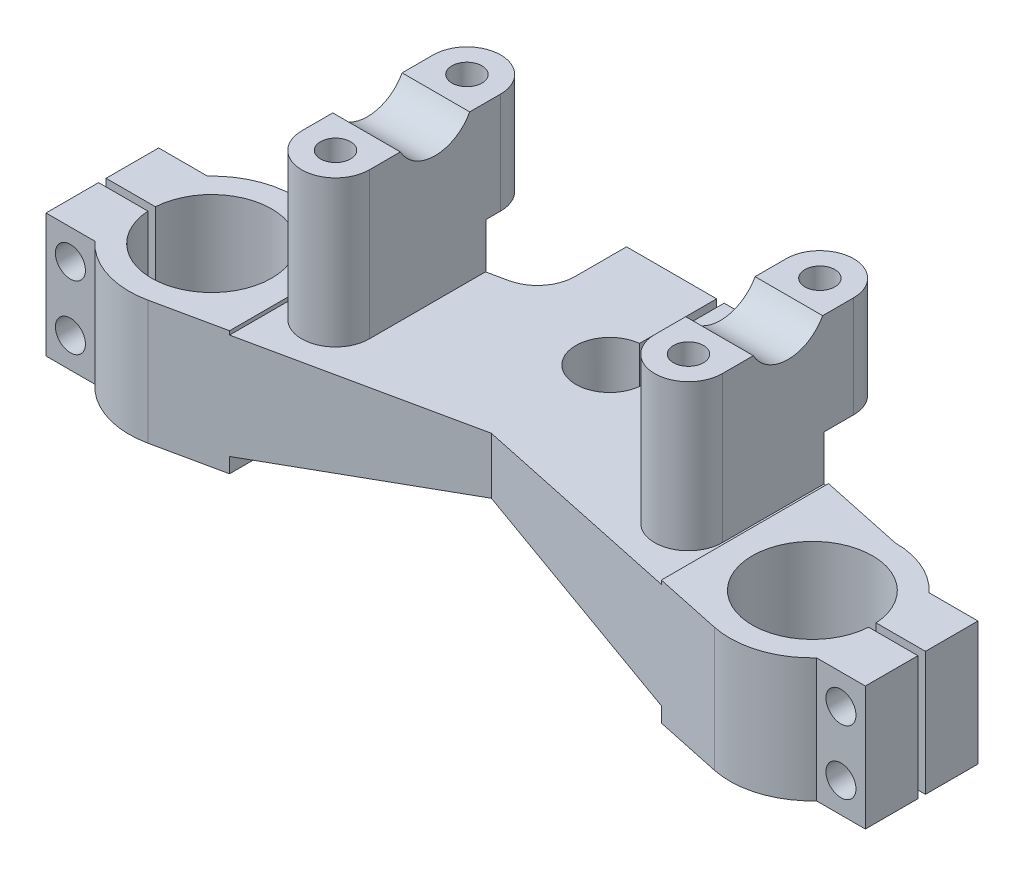
from build123d import *

# Parameters (mm, degrees)
BOSS_EXTRUDE1_DEPTH     = 33
FILLET2_R               = 10
FILLET3_R               = 10
CUT_EXTRUDE1_DEPTH      = 127.78010009
CUT_EXTRUDE1_DEPTH_BACK = 127.78010009
SKETCH3_W               = 115
SKETCH3_H               = 4.910725557
BOSS_EXTRUDE3_DEPTH     = 39
CUT_EXTRUDE5_DEPTH      = 65.5
CUT_EXTRUDE6_DEPTH      = 44
SKETCH9_R               = 4
CUT_EXTRUDE7_DEPTH      = 44
SKETCH10_R              = 4
CUT_EXTRUDE8_DEPTH      = 22
SKETCH11_R              = 4
CUT_EXTRUDE9_DEPTH      = 31
SKETCH12_R              = 10.5
CUT_EXTRUDE10_DEPTH     = 106.5


with BuildPart() as part:
    # Sketch1 → Boss-Extrude1 (new body)
    with BuildSketch(Plane(origin=(0, 0, 0), x_dir=(1, 0, 0), z_dir=(0, 1, 0))):
        with BuildLine():
            Line((-25, 55.5), (-25, 33.696074146))
            Line((-25, 33.696074146), (-80, 22.008574146))
            ThreePointArc((-80, 22.008574146), (-88.782047704, 20.180509757), (-96.105195929, 15))
            Line((-96.105195929, 15), (-109.105195929, 15))
            Line((-109.105195929, 15), (-109.105195929, 1))
            Line((-109.105195929, 1), (-95.968719423, 1))
            ThreePointArc((-95.968719423, 1), (-64, 0), (-95.968719423, -1))
            Line((-95.968719423, -1), (-109.105195929, -1))
            Line((-109.105195929, -1), (-109.105195929, -15))
            Line((-109.105195929, -15), (-96.105195929, -15))
            ThreePointArc((-96.105195929, -15), (-86.625068957, -20.987753506), (-75.425325161, -21.527881597))
            Line((-75.425325161, -21.527881597), (0, -5.5))
            Line((0, -5.5), (75.425325161, -21.527881597))
            ThreePointArc((75.425325161, -21.527881597), (86.625068957, -20.987753506), (96.105195929, -15))
            Line((96.105195929, -15), (109.105195929, -15))
            Line((109.105195929, -15), (109.105195929, -1))
            Line((109.105195929, -1), (95.968719423, -1))
            ThreePointArc((95.968719423, -1), (64, 0), (95.968719423, 1))
            Line((95.968719423, 1), (109.105195929, 1))
            Line((109.105195929, 1), (109.105195929, 15))
            Line((109.105195929, 15), (96.105195929, 15))
            ThreePointArc((96.105195929, 15), (88.782047704, 20.180509757), (80, 22.008574146))
            Line((80, 22.008574146), (25, 33.696074146))
            Line((25, 33.696074146), (25, 55.5))
            Line((25, 55.5), (1, 55.5))
            Line((1, 55.5), (1, 34.94427191))
            ThreePointArc((1, 34.94427191), (0, 17), (-1, 34.94427191))
            Line((-1, 34.94427191), (-1, 55.5))
            Line((-1, 55.5), (-25, 55.5))
        make_face()
    extrude(amount=BOSS_EXTRUDE1_DEPTH)

    # Fillet2
    fillet2_edges = [part.edges().sort_by_distance(p)[0] for p in [
        (25, 16.5, -33.696074146),
    ]]
    fillet(fillet2_edges, radius=FILLET2_R)

    # Fillet3
    fillet3_edges = [part.edges().sort_by_distance(p)[0] for p in [
        (-25, 16.5, -33.696074146),
    ]]
    fillet(fillet3_edges, radius=FILLET3_R)

    # Sketch3 → Cut-Extrude1 (cut, two sides: drawn at the far end of the back side and taken through both)
    with BuildSketch(Plane.XY.offset(-CUT_EXTRUDE1_DEPTH_BACK)):
        with Locations((0, 34.455362779)):
            Rectangle(SKETCH3_W, SKETCH3_H)
        Polygon((-57.5, 4), (-57.5, -3.298292375), (57.5, -3.298292375), (57.5, 4), (0, 17), align=None)
    extrude(amount=CUT_EXTRUDE1_DEPTH + CUT_EXTRUDE1_DEPTH_BACK, mode=Mode.SUBTRACT)

    # Sketch5 → Boss-Extrude3 (add)
    with BuildSketch(Plane(origin=(0, 71, 0), x_dir=(1, 0, 0), z_dir=(0, 1, 0))):
        with BuildLine():
            Line((-38, 0), (-38, 35))
            ThreePointArc((-38, 35), (-47, 44), (-56, 35))
            Line((-56, 35), (-56, 0))
            ThreePointArc((-56, 0), (-47, -9), (-38, 0))
        make_face()
        with BuildLine():
            Line((56, 0), (56, 35))
            ThreePointArc((56, 35), (47, 44), (38, 35))
            Line((38, 35), (38, 0))
            ThreePointArc((38, 0), (47, -9), (56, 0))
        make_face()
    extrude(amount=-BOSS_EXTRUDE3_DEPTH)

    # Sketch6 → Cut-Extrude5 (cut, symmetric)
    with BuildSketch(Plane(origin=(0, 0, 0), x_dir=(0, 0, -1), z_dir=(1, 0, 0))):
        Polygon((44, 71), (44, 44), (31.054287073, 44), (31.054287073, 32), (44, 32), (62.918124126, 32), (62.918124126, 71), align=None)
    extrude(amount=CUT_EXTRUDE5_DEPTH, both=True, mode=Mode.SUBTRACT)

    # Sketch7 → Cut-Extrude6 (cut)
    with BuildSketch(Plane(origin=(0, 0, 0), x_dir=(1, 0, 0), z_dir=(0, 1, 0))):
        Polygon((-56, 31.054287073), (-38, 31.054287073), (-56, 27.108574146), align=None)
        Polygon((56, 27.108574146), (56, 31.054287073), (38, 31.054287073), align=None)
    extrude(amount=CUT_EXTRUDE6_DEPTH, mode=Mode.SUBTRACT)

    # Sketch9 → Cut-Extrude7 (cut)
    with BuildSketch(Plane(origin=(0, 71, 0), x_dir=(1, 0, 0), z_dir=(0, 1, 0))):
        with Locations(Location((-47, 0, 0), (0, 0, 270))):
            Circle(SKETCH9_R)
        with Locations(Location((-47, 35, 0), (0, 0, 270))):
            Circle(SKETCH9_R)
        with Locations(Location((47, 0, 0), (0, 0, 270))):
            Circle(SKETCH9_R)
        with Locations(Location((47, 35, 0), (0, 0, 270))):
            Circle(SKETCH9_R)
    extrude(amount=-CUT_EXTRUDE7_DEPTH, mode=Mode.SUBTRACT)

    # Sketch10 → Cut-Extrude8 (cut, symmetric)
    with BuildSketch(Plane.XY):
        with Locations((-102.605195929, 8)):
            Circle(SKETCH10_R)
        with Locations((-102.605195929, 25)):
            Circle(SKETCH10_R)
        with Locations((102.605195929, 8)):
            Circle(SKETCH10_R)
        with Locations((102.605195929, 25)):
            Circle(SKETCH10_R)
    extrude(amount=CUT_EXTRUDE8_DEPTH, both=True, mode=Mode.SUBTRACT)

    # Sketch11 → Cut-Extrude9 (cut, symmetric)
    with BuildSketch(Plane(origin=(0, 0, 0), x_dir=(0, 0, -1), z_dir=(1, 0, 0))):
        with Locations((48.647181255, 21.673913043)):
            Circle(SKETCH11_R)
    extrude(amount=CUT_EXTRUDE9_DEPTH, both=True, mode=Mode.SUBTRACT)

    # Sketch12 → Cut-Extrude10 (cut, symmetric)
    with BuildSketch(Plane(origin=(0, 0, 0), x_dir=(0, 0, -1), z_dir=(1, 0, 0))):
        with Locations((17.5, 76)):
            Circle(SKETCH12_R)
    extrude(amount=CUT_EXTRUDE10_DEPTH, both=True, mode=Mode.SUBTRACT)


solid = part.part
